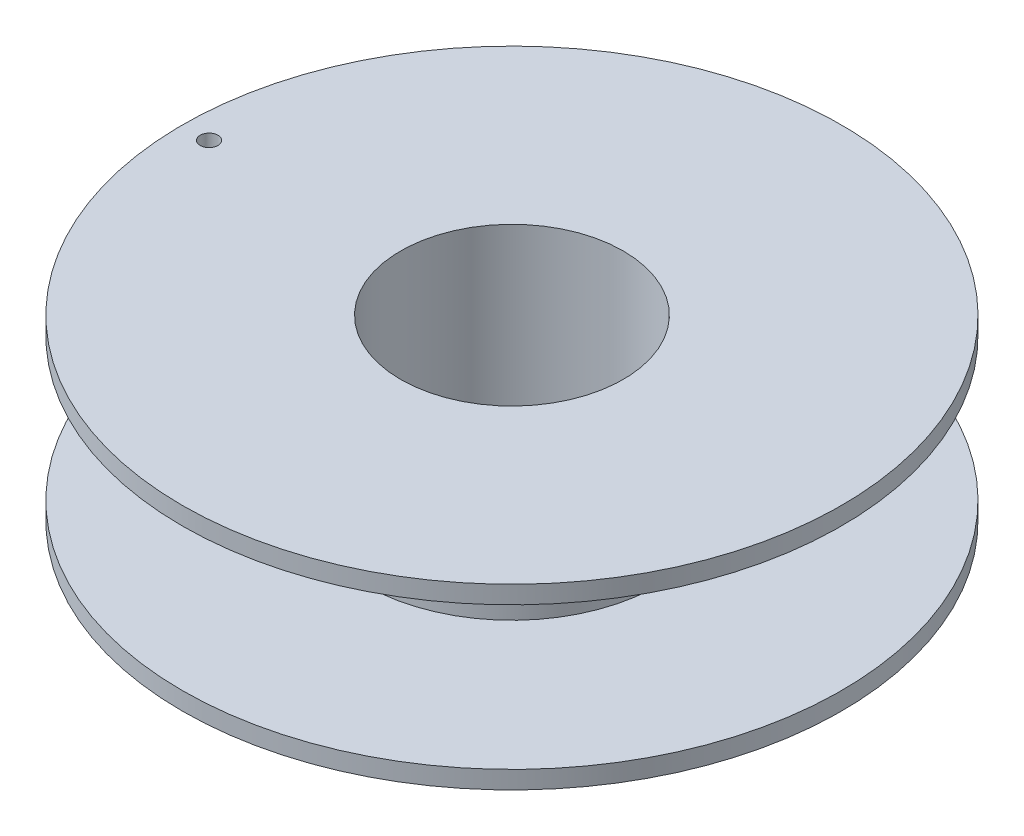
from build123d import *

# Parameters (mm, degrees)
SKETCH_2_R          = 6.75
SKETCH_2_R_2        = 6.25
EXTRUDE_1_DEPTH     = 5
SKETCH_3_R          = 18.5
SKETCH_3_R_2        = 6.75
EXTRUDE_4_DEPTH     = 5
SKETCH_6_R          = 18.5
SKETCH_6_R_2        = 8.25
CUT_EXTRUDE_3_DEPTH = 4
SKETCH_7_R          = 0.5
CUT_EXTRUDE_4_DEPTH = 27.636441204
CUT_EXTRUDE_5_REACH = 30.009
SKETCH_8_R          = 0.5


with BuildPart() as part:
    # 草图2 → 凸台-拉伸1 (new, symmetric)
    with BuildSketch(Plane(origin=(0, 0, 0), x_dir=(1, 0, 0), z_dir=(0, 1, 0))):
        with Locations(Location((0, 0, 0), (0, 0, 270))):
            Circle(SKETCH_2_R)
        with Locations(Location((0, 0, 0), (0, 0, 270))):
            Circle(SKETCH_2_R_2, mode=Mode.SUBTRACT)
    extrude(amount=EXTRUDE_1_DEPTH, both=True)

    # 草图3 → 凸台-拉伸4 (add, symmetric)
    with BuildSketch(Plane(origin=(0, 0, 0), x_dir=(1, 0, 0), z_dir=(0, 1, 0))):
        with Locations(Location((0, 0, 0), (0, 0, 270))):
            Circle(SKETCH_3_R)
        Circle(SKETCH_3_R_2, mode=Mode.SUBTRACT)
    extrude(amount=EXTRUDE_4_DEPTH, both=True)

    # 草图6 → 切除-拉伸3 (cut, symmetric)
    with BuildSketch(Plane(origin=(0, 0, 0), x_dir=(1, 0, 0), z_dir=(0, 1, 0))):
        with Locations(Location((0, 0, 0), (0, 0, 270))):
            Circle(SKETCH_6_R)
        with Locations(Location((0, 0, 0), (0, 0, 270))):
            Circle(SKETCH_6_R_2, mode=Mode.SUBTRACT)
    extrude(amount=CUT_EXTRUDE_3_DEPTH, both=True, mode=Mode.SUBTRACT)

    # 草图7 → 切除-拉伸4 (cut, through all)
    with BuildSketch(Plane(origin=(0, 0, 0), x_dir=(0, 0, -1), z_dir=(1, 0, 0))):
        with Locations((0, -3.25)):
            Circle(SKETCH_7_R)
    extrude(amount=-CUT_EXTRUDE_4_DEPTH, mode=Mode.SUBTRACT)

    # 草图8 → 切除-拉伸5 (cut, up to next)
    with BuildSketch(Plane(origin=(0, 5, 0), x_dir=(1, 0, 0), z_dir=(0, 1, 0)), mode=Mode.PRIVATE) as cut_extrude_5_sk1:
        with Locations(Location((-17, 0, 0), (0, 0, 270))):
            Circle(SKETCH_8_R)
    cut_extrude_5_tool1 = extrude(cut_extrude_5_sk1.sketch, amount=-CUT_EXTRUDE_5_REACH, mode=Mode.PRIVATE) & part.part
    add(cut_extrude_5_tool1.solids().sort_by_distance((-17, 5, 0))[0], mode=Mode.SUBTRACT)


solid = part.part
